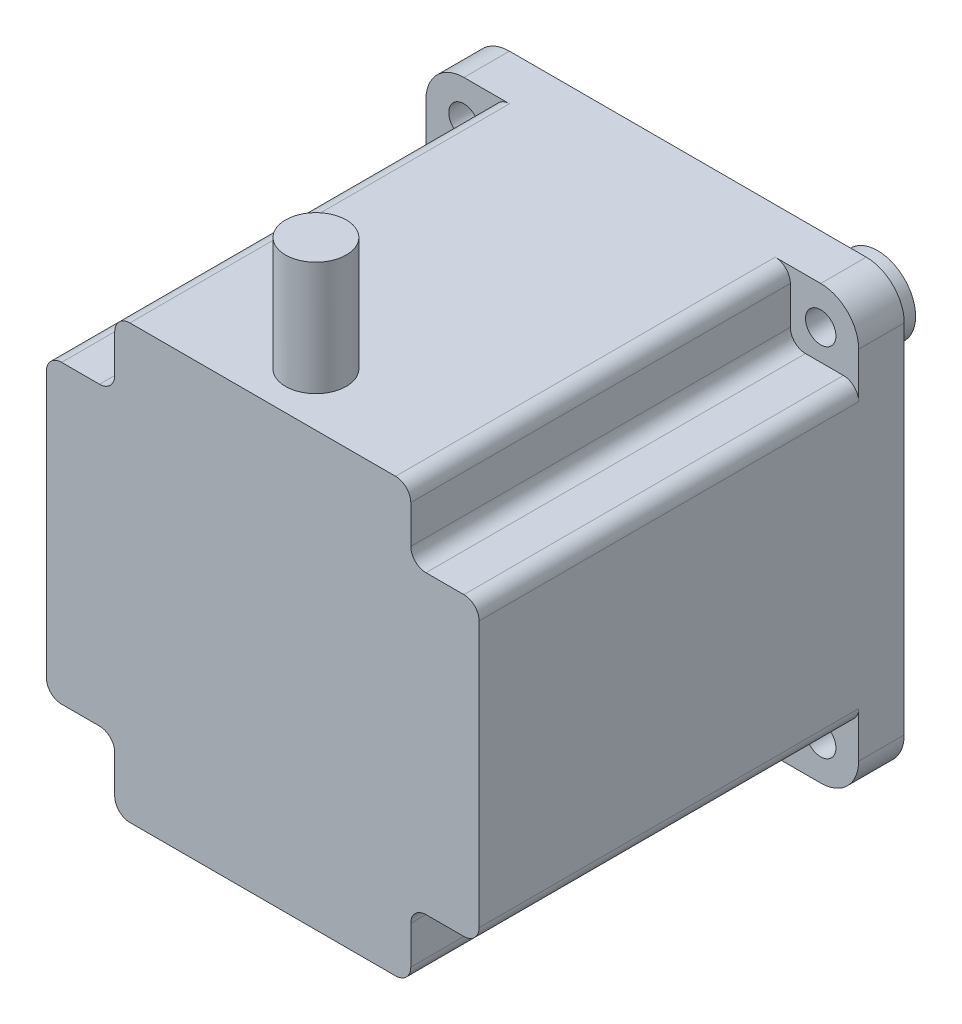
from build123d import *

# Parameters (mm, degrees)
EXTRUDE_1_DEPTH     = 56
CUT_EXTRUDE_START   = -50
CUT_EXTRUDE_1_DEPTH = 50
FILLET_1_R          = 2
SKETCH_3_R          = 2
CUT_EXTRUDE_2_DEPTH = 65.222270281
SKETCH_4_R          = 5
EXTRUDE_2_DEPTH     = 25
SKETCH_5_R          = 4
EXTRUDE_3_DEPTH     = 15


with BuildPart() as part:
    # 草图1 → 凸台-拉伸1 (new body)
    with BuildSketch(Plane.XY):
        with BuildLine():
            Line((-23.5, 28.5), (23.5, 28.5))
            ThreePointArc((23.5, 28.5), (27.035533906, 27.035533906), (28.5, 23.5))
            Line((28.5, 23.5), (28.5, -23.5))
            ThreePointArc((28.5, -23.5), (27.035533906, -27.035533906), (23.5, -28.5))
            Line((23.5, -28.5), (-23.5, -28.5))
            ThreePointArc((-23.5, -28.5), (-27.035533906, -27.035533906), (-28.5, -23.5))
            Line((-28.5, -23.5), (-28.5, 23.5))
            ThreePointArc((-28.5, 23.5), (-27.035533906, 27.035533906), (-23.5, 28.5))
        make_face()
    extrude(amount=EXTRUDE_1_DEPTH)

    # 草图2 → 切除-拉伸1 (cut)
    with BuildSketch(Plane.XY.offset(56).offset(CUT_EXTRUDE_START)):
        with BuildLine():
            Line((-28.5, -19.5), (-19.5, -19.5))
            Line((-19.5, -19.5), (-19.5, -28.5))
            Line((-19.5, -28.5), (-23.5, -28.5))
            ThreePointArc((-23.5, -28.5), (-27.035533906, -27.035533906), (-28.5, -23.5))
            Line((-28.5, -23.5), (-28.5, -19.5))
        make_face()
        with BuildLine():
            Line((-28.5, 19.5), (-19.5, 19.5))
            Line((-19.5, 19.5), (-19.5, 28.5))
            Line((-19.5, 28.5), (-23.5, 28.5))
            ThreePointArc((-23.5, 28.5), (-27.035533906, 27.035533906), (-28.5, 23.5))
            Line((-28.5, 23.5), (-28.5, 19.5))
        make_face()
        with BuildLine():
            Line((23.5, 28.5), (19.5, 28.5))
            Line((19.5, 28.5), (19.5, 19.5))
            Line((19.5, 19.5), (28.5, 19.5))
            Line((28.5, 19.5), (28.5, 23.5))
            ThreePointArc((28.5, 23.5), (27.035533906, 27.035533906), (23.5, 28.5))
        make_face()
        with BuildLine():
            Line((28.5, -23.5), (28.5, -19.5))
            Line((28.5, -19.5), (19.5, -19.5))
            Line((19.5, -19.5), (19.5, -28.5))
            Line((19.5, -28.5), (23.5, -28.5))
            ThreePointArc((23.5, -28.5), (27.035533906, -27.035533906), (28.5, -23.5))
        make_face()
    extrude(amount=CUT_EXTRUDE_1_DEPTH, mode=Mode.SUBTRACT)

    # 圆角1
    fillet_1_edges = [part.edges().sort_by_distance(p)[0] for p in [
        (19.5, -28.5, 31),
        (19.5, -19.5, 31),
        (28.5, -19.5, 31),
        (-19.5, 28.5, 31),
        (-19.5, 19.5, 31),
        (-28.5, 19.5, 31),
        (28.5, 19.5, 31),
        (19.5, 19.5, 31),
        (19.5, 28.5, 31),
        (-28.5, -19.5, 31),
        (-19.5, -19.5, 31),
        (-19.5, -28.5, 31),
    ]]
    fillet(fillet_1_edges, radius=FILLET_1_R)

    # 草图3 → 切除-拉伸2 (cut, through all)
    with BuildSketch(Plane.XY.offset(6)):
        with Locations((-23.5, -23.5)):
            Circle(SKETCH_3_R)
        with Locations((-23.5, 23.5)):
            Circle(SKETCH_3_R)
        with Locations((23.5, 23.5)):
            Circle(SKETCH_3_R)
        with Locations((23.5, -23.5)):
            Circle(SKETCH_3_R)
    extrude(amount=-CUT_EXTRUDE_2_DEPTH, mode=Mode.SUBTRACT)

    # 草图4 → 凸台-拉伸2 (add)
    with BuildSketch(Plane(origin=(0, 0, 0), x_dir=(-1, 0, 0), z_dir=(0, 0, -1))):
        with Locations(Location((0, 0, 0), (0, 0, 180))):
            Circle(SKETCH_4_R)
    extrude(amount=EXTRUDE_2_DEPTH)

    # 草图5 → 凸台-拉伸3 (add)
    with BuildSketch(Plane(origin=(0, 28.5, 0), x_dir=(1, 0, 0), z_dir=(0, 1, 0))):
        with Locations((0, -49)):
            Circle(SKETCH_5_R)
    extrude(amount=EXTRUDE_3_DEPTH)


solid = part.part
